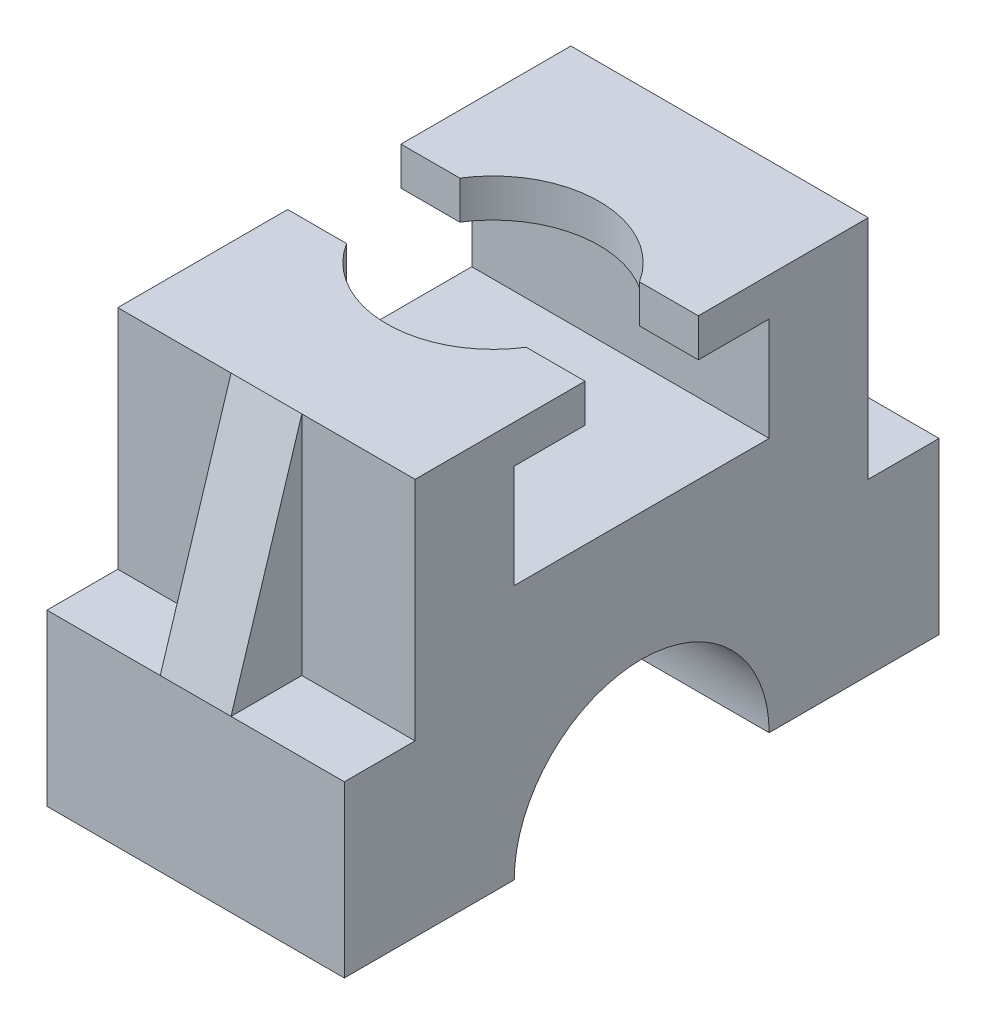
from build123d import *

# Parameters (mm, degrees)
BOSS_EXTRUDE1_DEPTH = 52.5
RIB1_REACH          = 184.705
SKETCH3_WALL_W      = 451.226000884
SKETCH3_WALL_H      = 25
RIB2_REACH          = 184.705
SKETCH2_WALL_W      = 451.226000884
SKETCH2_WALL_H      = 25
CUT_EXTRUDE1_DEPTH  = 31


with BuildPart() as part:
    # Sketch1 → Boss-Extrude1 (new, symmetric)
    with BuildSketch(Plane(origin=(0, 0, 0), x_dir=(0, 0, -1), z_dir=(1, 0, 0))):
        with BuildLine():
            Line((45, 0), (105, 0))
            Line((105, 0), (105, 60))
            Line((105, 60), (80, 60))
            Line((80, 60), (80, 140))
            Line((80, 140), (20, 140))
            Line((20, 140), (20, 126.52173913))
            Line((20, 126.52173913), (45, 126.52173913))
            Line((45, 126.52173913), (45, 90))
            Line((45, 90), (-45, 90))
            Line((-45, 90), (-45, 126.52173913))
            Line((-45, 126.52173913), (-20, 126.52173913))
            Line((-20, 126.52173913), (-20, 140))
            Line((-20, 140), (-80, 140))
            Line((-80, 140), (-80, 60))
            Line((-80, 60), (-105, 60))
            Line((-105, 60), (-105, 0))
            Line((-105, 0), (-45, 0))
            ThreePointArc((-45, 0), (0, 45), (45, 0))
        make_face()
    extrude(amount=BOSS_EXTRUDE1_DEPTH, both=True)

    # Sketch3 wall → Rib1 (add, up to next)
    with BuildSketch(Plane(origin=(0, 100, 92.5), x_dir=(0, -0.954479978035, 0.298274993136), z_dir=(0, -0.298274993136, -0.954479978035)), mode=Mode.PRIVATE) as rib1_sk1:
        Rectangle(SKETCH3_WALL_W, SKETCH3_WALL_H)
    rib1_tool1 = extrude(rib1_sk1.sketch, amount=RIB1_REACH, mode=Mode.PRIVATE) - part.part
    add(rib1_tool1.solids().sort_by_distance((0, 100, 92.5))[0])

    # Sketch2 wall → Rib2 (add, up to next)
    with BuildSketch(Plane(origin=(0, 100, -92.5), x_dir=(0, -0.954479978035, -0.298274993136), z_dir=(0, 0.298274993136, -0.954479978035)), mode=Mode.PRIVATE) as rib2_sk1:
        Rectangle(SKETCH2_WALL_W, SKETCH2_WALL_H)
    rib2_tool1 = extrude(rib2_sk1.sketch, amount=-RIB2_REACH, mode=Mode.PRIVATE) - part.part
    add(rib2_tool1.solids().sort_by_distance((0, 100, -92.5))[0])

    # Sketch5 → Cut-Extrude1 (cut)
    with BuildSketch(Plane(origin=(0, 140, 0), x_dir=(1, 0, 0), z_dir=(0, 1, 0))):
        with BuildLine():
            Line((31.721443851, -20), (-31.721443851, -20))
            ThreePointArc((-31.721443851, -20), (0, -37.5), (31.721443851, -20))
        make_face()
        with BuildLine():
            Line((31.721443851, 20), (-31.721443851, 20))
            ThreePointArc((-31.721443851, 20), (0, 37.5), (31.721443851, 20))
        make_face()
    extrude(amount=-CUT_EXTRUDE1_DEPTH, mode=Mode.SUBTRACT)


solid = part.part
